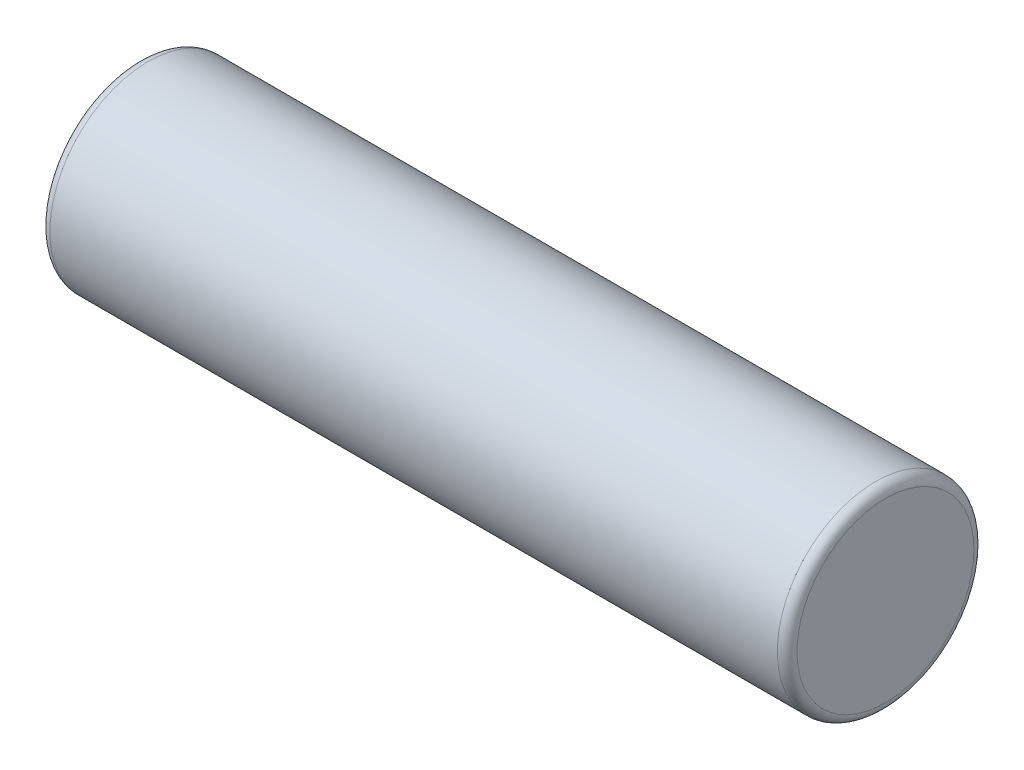
from build123d import *

# Parameters (mm, degrees)
BOSS_EXTRUDE1_DEPTH      = 38
BOSS_EXTRUDE1_DEPTH_BACK = 38
SKETCH1_R                = 10
FILLET1_R                = 1


with BuildPart() as part:
    # Sketch1 → Boss-Extrude1 (new, two sides: drawn at the far end of the back side and taken through both)
    with BuildSketch(Plane(origin=(0, 0, 0), x_dir=(0, 0, -1), z_dir=(1, 0, 0)).offset(-BOSS_EXTRUDE1_DEPTH_BACK)):
        Circle(SKETCH1_R)
    extrude(amount=BOSS_EXTRUDE1_DEPTH + BOSS_EXTRUDE1_DEPTH_BACK)

    # Fillet1
    fillet1_edges = [part.edges().sort_by_distance(p)[0] for p in [
        (-38, 0, 10),
        (38, 0, 10),
    ]]
    fillet(fillet1_edges, radius=FILLET1_R)


solid = part.part
